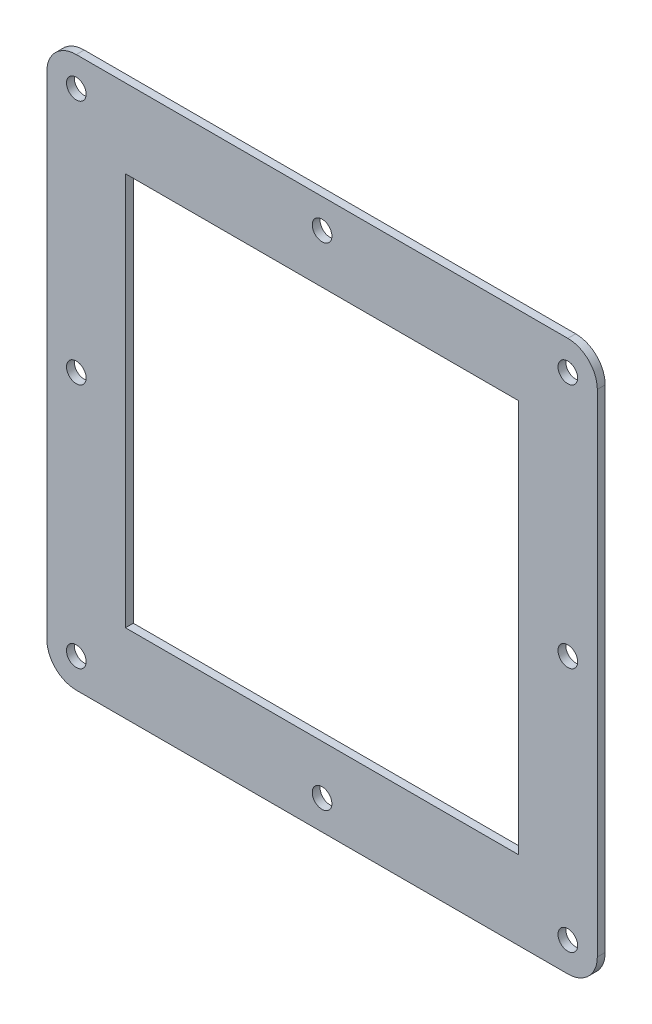
from build123d import *

# Parameters (mm, degrees)
SKETCH2_R           = 5
SKETCH2_R_2         = 4
BOSS_EXTRUDE1_DEPTH = 4
SKETCH3_W           = 200
SKETCH3_H           = 200
CUT_EXTRUDE1_DEPTH  = 10


with BuildPart() as part:
    # Sketch2 → Boss-Extrude1 (new body)
    with BuildSketch(Plane.XY):
        with BuildLine():
            Line((-125, 140), (125, 140))
            ThreePointArc((125, 140), (135.606601718, 135.606601718), (140, 125))
            Line((140, 125), (140, -125))
            ThreePointArc((140, -125), (135.606601718, -135.606601718), (125, -140))
            Line((125, -140), (-125, -140))
            ThreePointArc((-125, -140), (-135.606601718, -135.606601718), (-140, -125))
            Line((-140, -125), (-140, 125))
            ThreePointArc((-140, 125), (-135.606601718, 135.606601718), (-125, 140))
        make_face()
        with Locations((-125, 125)):
            Circle(SKETCH2_R, mode=Mode.SUBTRACT)
        with Locations((0, 125)):
            Circle(SKETCH2_R, mode=Mode.SUBTRACT)
        with Locations((125, 125)):
            Circle(SKETCH2_R, mode=Mode.SUBTRACT)
        Circle(SKETCH2_R_2, mode=Mode.SUBTRACT)
        with Locations((125, 0)):
            Circle(SKETCH2_R, mode=Mode.SUBTRACT)
        with Locations((-125, 0)):
            Circle(SKETCH2_R, mode=Mode.SUBTRACT)
        with Locations((-125, -125)):
            Circle(SKETCH2_R, mode=Mode.SUBTRACT)
        with Locations((0, -125)):
            Circle(SKETCH2_R, mode=Mode.SUBTRACT)
        with Locations((125, -125)):
            Circle(SKETCH2_R, mode=Mode.SUBTRACT)
    extrude(amount=BOSS_EXTRUDE1_DEPTH)

    # Sketch3 → Cut-Extrude1 (cut)
    with BuildSketch(Plane.XY.offset(4)):
        Rectangle(SKETCH3_W, SKETCH3_H)
    extrude(amount=-CUT_EXTRUDE1_DEPTH, mode=Mode.SUBTRACT)


solid = part.part
